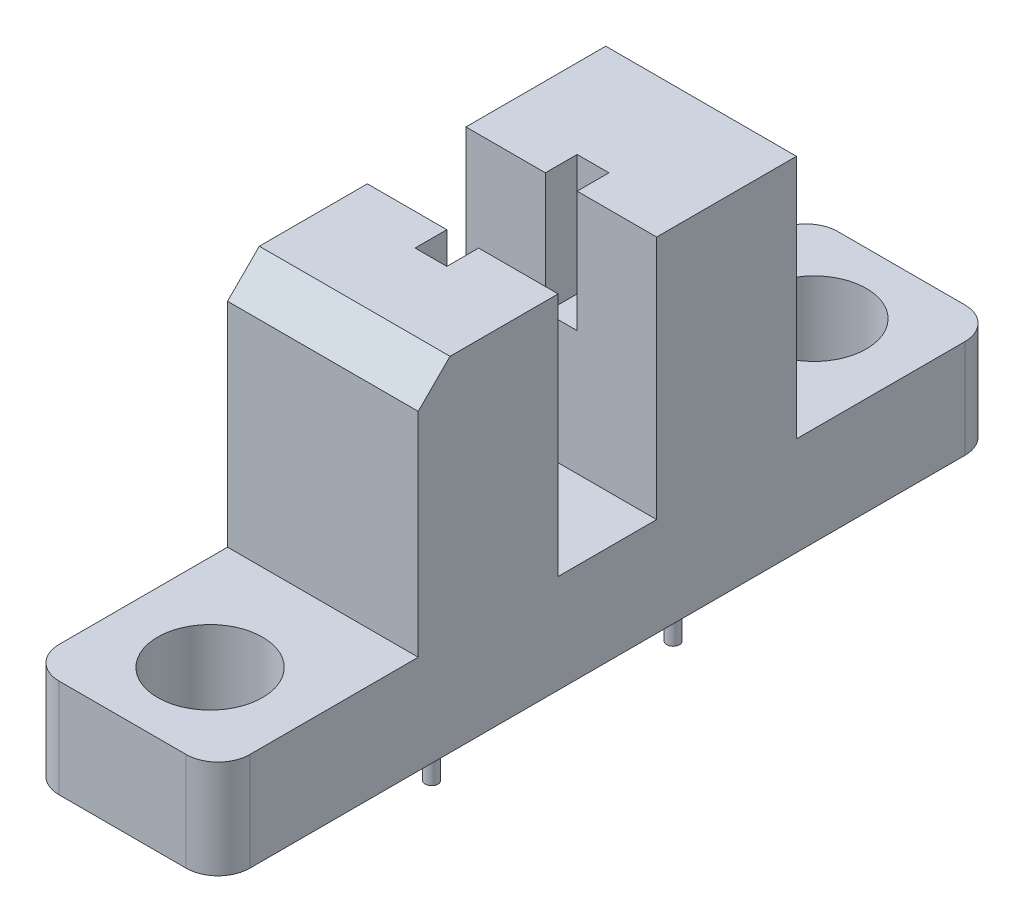
from build123d import *

# Parameters (mm, degrees)
SKETCH_1_W          = 24.5
SKETCH_1_H          = 3.1
EXTRUDE_1_DEPTH     = 3
FILLET_1_R          = 1
EXTRUDE_START       = -3.1
SKETCH_2_W          = 6
SKETCH_2_H          = 4.4
EXTRUDE_2_DEPTH     = 10.8
CUT_EXTRUDE_1_REACH = 16.777
SKETCH_2_3_R        = 1.65
CHAMFER_1_SIZE      = 1
SKETCH_3_W          = 1
SKETCH_3_H          = 1
CUT_EXTRUDE_2_DEPTH = 3.8
SKETCH_4_R          = 0.2
EXTRUDE_3_DEPTH     = 2.2


with BuildPart() as part:
    # Эскиз1 → Бобышка-Вытянуть1 (new, symmetric)
    with BuildSketch(Plane(origin=(0, 0, 0), x_dir=(0, 0, -1), z_dir=(1, 0, 0))):
        Rectangle(SKETCH_1_W, SKETCH_1_H)
    extrude(amount=EXTRUDE_1_DEPTH, both=True)

    # Скругление1
    fillet_1_edges = [part.edges().sort_by_distance(p)[0] for p in [
        (3, 0, 12.25),
        (-3, 0, 12.25),
        (-3, 0, -12.25),
        (3, 0, -12.25),
    ]]
    fillet(fillet_1_edges, radius=FILLET_1_R)

    # Эскиз2 → Бобышка-Вытянуть2 (add)
    with BuildSketch(Plane(origin=(0, 1.55, 0), x_dir=(1, 0, 0), z_dir=(0, 1, 0)).offset(EXTRUDE_START)):
        with Locations((0, 3.75)):
            Rectangle(SKETCH_2_W, SKETCH_2_H)
        with Locations((0, -3.75)):
            Rectangle(SKETCH_2_W, SKETCH_2_H)
    extrude(amount=EXTRUDE_2_DEPTH)

    # Эскиз2<3> → Вырез-Вытянуть1 (cut, up to next)
    with BuildSketch(Plane(origin=(0, 1.55, 0), x_dir=(1, 0, 0), z_dir=(0, 1, 0)), mode=Mode.PRIVATE) as cut_extrude_1_sk1:
        with Locations(Location((0, -9.5, 0), (0, 0, 270))):
            Circle(SKETCH_2_3_R)
    cut_extrude_1_tool1 = extrude(cut_extrude_1_sk1.sketch, amount=-CUT_EXTRUDE_1_REACH, mode=Mode.PRIVATE) & part.part
    # Эскиз2<3> → Вырез-Вытянуть1 (cut, up to next)
    with BuildSketch(Plane(origin=(0, 1.55, 0), x_dir=(1, 0, 0), z_dir=(0, 1, 0)), mode=Mode.PRIVATE) as cut_extrude_1_sk2:
        with Locations(Location((0, 9.5, 0), (0, 0, 270))):
            Circle(SKETCH_2_3_R)
    cut_extrude_1_tool2 = extrude(cut_extrude_1_sk2.sketch, amount=-CUT_EXTRUDE_1_REACH, mode=Mode.PRIVATE) & part.part
    add(cut_extrude_1_tool1.solids().sort_by_distance((0, 1.55, 9.5))[0], mode=Mode.SUBTRACT)
    add(cut_extrude_1_tool2.solids().sort_by_distance((0, 1.55, -9.5))[0], mode=Mode.SUBTRACT)

    # Фаска1
    chamfer_1_edges = [part.edges().sort_by_distance(p)[0] for p in [
        (0, 9.25, 5.95),
    ]]
    chamfer(chamfer_1_edges, length=CHAMFER_1_SIZE)

    # Эскиз3 → Вырез-Вытянуть2 (cut)
    with BuildSketch(Plane(origin=(0, 9.25, 0), x_dir=(1, 0, 0), z_dir=(0, 1, 0))):
        with Locations((0, 2.05)):
            Rectangle(SKETCH_3_W, SKETCH_3_H)
        with Locations((0, -2.05)):
            Rectangle(SKETCH_3_W, SKETCH_3_H)
    extrude(amount=-CUT_EXTRUDE_2_DEPTH, mode=Mode.SUBTRACT)

    # Эскиз4 → Бобышка-Вытянуть3 (add)
    with BuildSketch(Plane.XZ.offset(1.55)):
        with Locations(Location((-1.27, 3.8, 0), (0, 0, 90))):
            Circle(SKETCH_4_R)
        with Locations(Location((1.27, 3.8, 0), (0, 0, 90))):
            Circle(SKETCH_4_R)
        with Locations(Location((1.27, -3.8, 0), (0, 0, 90))):
            Circle(SKETCH_4_R)
        with Locations(Location((-1.27, -3.8, 0), (0, 0, 90))):
            Circle(SKETCH_4_R)
    extrude(amount=EXTRUDE_3_DEPTH)


solid = part.part
